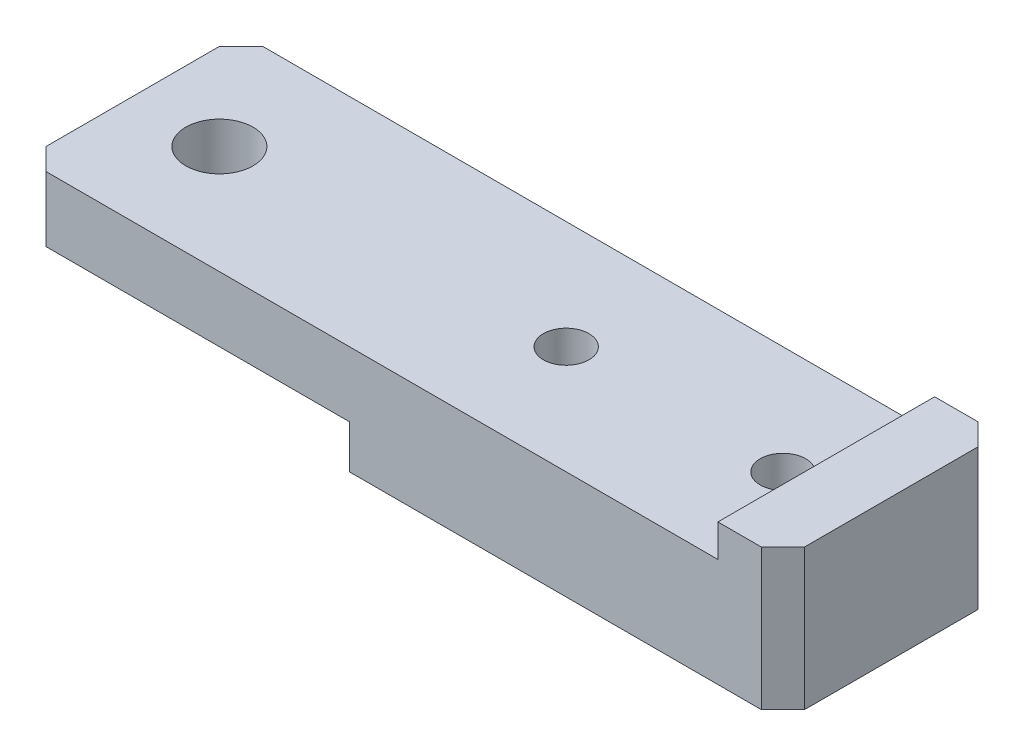
from build123d import *

# Parameters (mm, degrees)
EXTRUDE_1_DEPTH     = 10
SKETCH_3_R          = 5
EXTRUDE_2_DEPTH     = 4
CHAMFER_1_SIZE      = 2
CHAMFER_2_SIZE      = 2
SKETCH_4_R          = 2.1
SKETCH_4_R_2        = 3.1
CUT_EXTRUDE_1_DEPTH = 72.895757872
FILLET_1_R          = 1


with BuildPart() as part:
    # 草图1 → 凸台-拉伸1 (new, symmetric)
    with BuildSketch(Plane.XY):
        Polygon((0, 6), (0, 12), (64, 12), (64, 15), (70, 15), (70, 12), (70, 2), (30, 2), (30, 6), align=None)
    extrude(amount=EXTRUDE_1_DEPTH, both=True)

    # 草图3 → 凸台-拉伸2 (add)
    with BuildSketch(Plane.XZ.offset(-6)):
        with Locations(Location((8, 0, 0), (0, 0, 90))):
            Circle(SKETCH_3_R)
    extrude(amount=EXTRUDE_2_DEPTH)

    # 倒角1
    chamfer_1_edges = [part.edges().sort_by_distance(p)[0] for p in [
        (0, 9, -10),
        (0, 9, 10),
    ]]
    chamfer(chamfer_1_edges, length=CHAMFER_1_SIZE)

    # 倒角2
    chamfer_2_edges = [part.edges().sort_by_distance(p)[0] for p in [
        (70, 8.5, 10),
        (70, 8.5, -10),
    ]]
    chamfer(chamfer_2_edges, length=CHAMFER_2_SIZE)

    # 草图4 → 切除-拉伸1 (cut, through all)
    with BuildSketch(Plane.XZ.offset(-2)):
        with Locations((40, 0)):
            Circle(SKETCH_4_R)
        with Locations((60, 0)):
            Circle(SKETCH_4_R)
        with Locations((8, 0)):
            Circle(SKETCH_4_R_2)
    extrude(amount=-CUT_EXTRUDE_1_DEPTH, mode=Mode.SUBTRACT)

    # 圆角1
    fillet_1_edges = [part.edges().sort_by_distance(p)[0] for p in [
        (8, 6, -5),
    ]]
    fillet(fillet_1_edges, radius=FILLET_1_R)


solid = part.part
